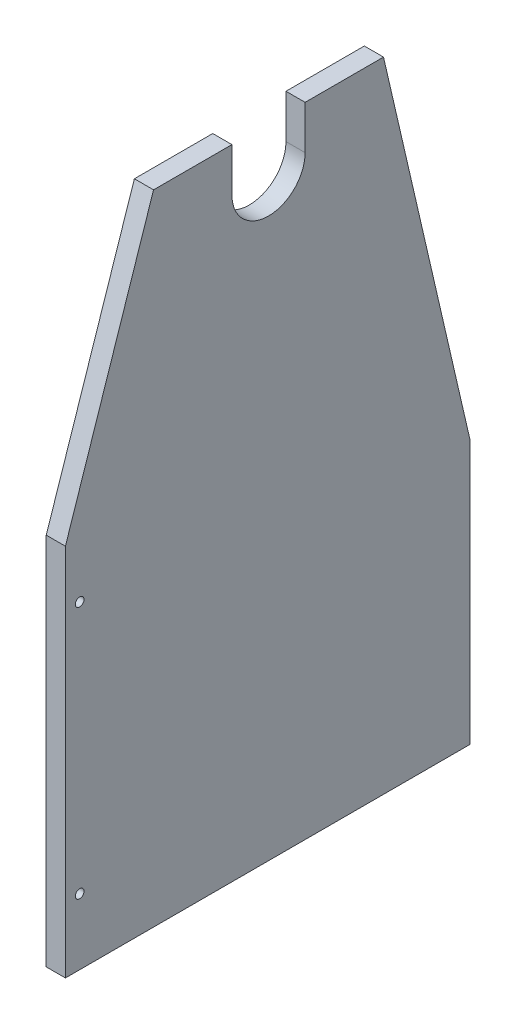
from build123d import *

# Parameters (mm, degrees)
BOSS_EXTRUDE1_DEPTH = 17.4625
CUT_EXTRUDE1_DEPTH  = 17.4625
SKETCH2_R           = 3.96875
CUT_EXTRUDE2_DEPTH  = 17.4625


with BuildPart() as part:
    # Sketch1 → Boss-Extrude1 (new body)
    with BuildSketch(Plane(origin=(0, 0, 0), x_dir=(0, 0, -1), z_dir=(1, 0, 0))):
        Polygon((0, 0), (368.3, 0), (368.3, 241.3), (289.73584427, 581.598745126), (80.26426737, 581.598745126), (0, 340.614), align=None)
    extrude(amount=BOSS_EXTRUDE1_DEPTH)

    # RockerBoxCutout → Cut-Extrude1 (cut)
    with BuildSketch(Plane(origin=(17.4625, 0, 0), x_dir=(0, 0, -1), z_dir=(1, 0, 0))):
        with BuildLine():
            ThreePointArc((218.33755582, 541.911245126), (185.00005582, 575.248745126), (151.66255582, 541.911245126))
            Line((151.66255582, 541.911245126), (218.33755582, 541.911245126))
        make_face()
        with BuildLine():
            Line((218.33755582, 541.911245126), (151.66255582, 541.911245126))
            ThreePointArc((151.66255582, 541.911245126), (185.00005582, 508.573745126), (218.33755582, 541.911245126))
        make_face()
        with BuildLine():
            Line((151.66255582, 581.598745126), (151.66255582, 541.911245126))
            ThreePointArc((151.66255582, 541.911245126), (185.00005582, 575.248745126), (218.33755582, 541.911245126))
            Line((218.33755582, 541.911245126), (218.33755582, 581.598745126))
            Line((218.33755582, 581.598745126), (151.66255582, 581.598745126))
        make_face()
    extrude(amount=-CUT_EXTRUDE1_DEPTH, mode=Mode.SUBTRACT)

    # Sketch2 → Cut-Extrude2 (cut)
    with BuildSketch(Plane.ZY):
        with Locations((-13, 60)):
            Circle(SKETCH2_R)
        with Locations((-13, 290.1875)):
            Circle(SKETCH2_R)
    extrude(amount=-CUT_EXTRUDE2_DEPTH, mode=Mode.SUBTRACT)


solid = part.part
